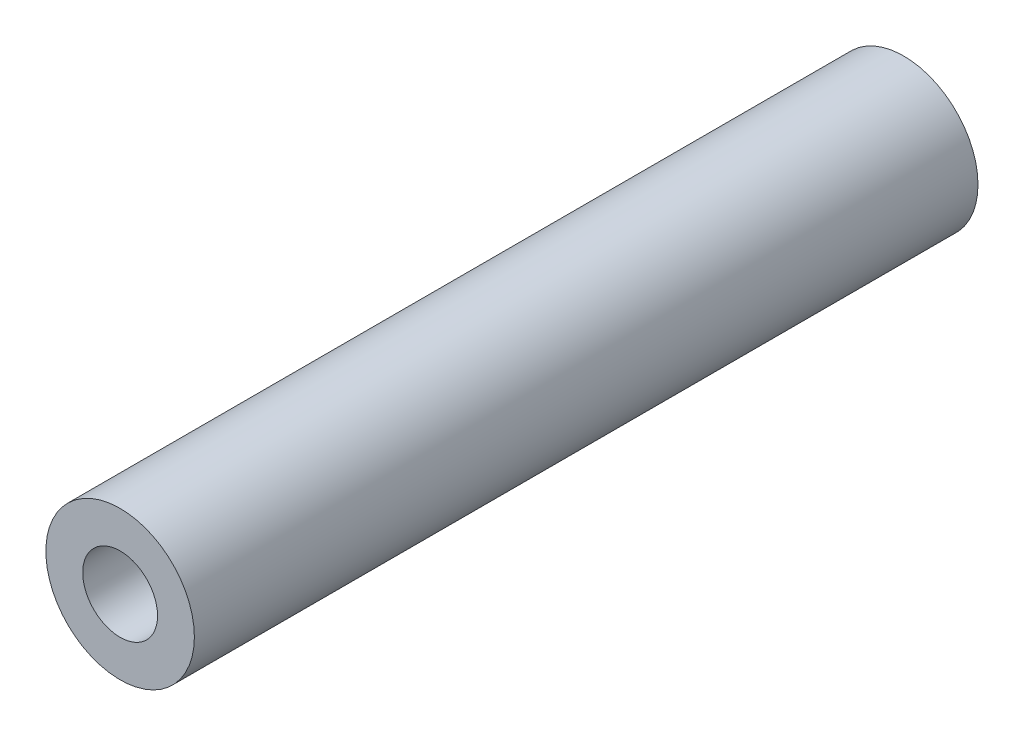
from build123d import *

# Parameters (mm, degrees)
SKETCH1_R      = 6.35
SKETCH1_R_2    = 3.2004
EXTRUDE1_DEPTH = 33.5026


with BuildPart() as part:
    # Sketch1 → Extrude1 (new, symmetric)
    with BuildSketch(Plane.XY):
        Circle(SKETCH1_R)
        Circle(SKETCH1_R_2, mode=Mode.SUBTRACT)
    extrude(amount=EXTRUDE1_DEPTH, both=True)


solid = part.part
